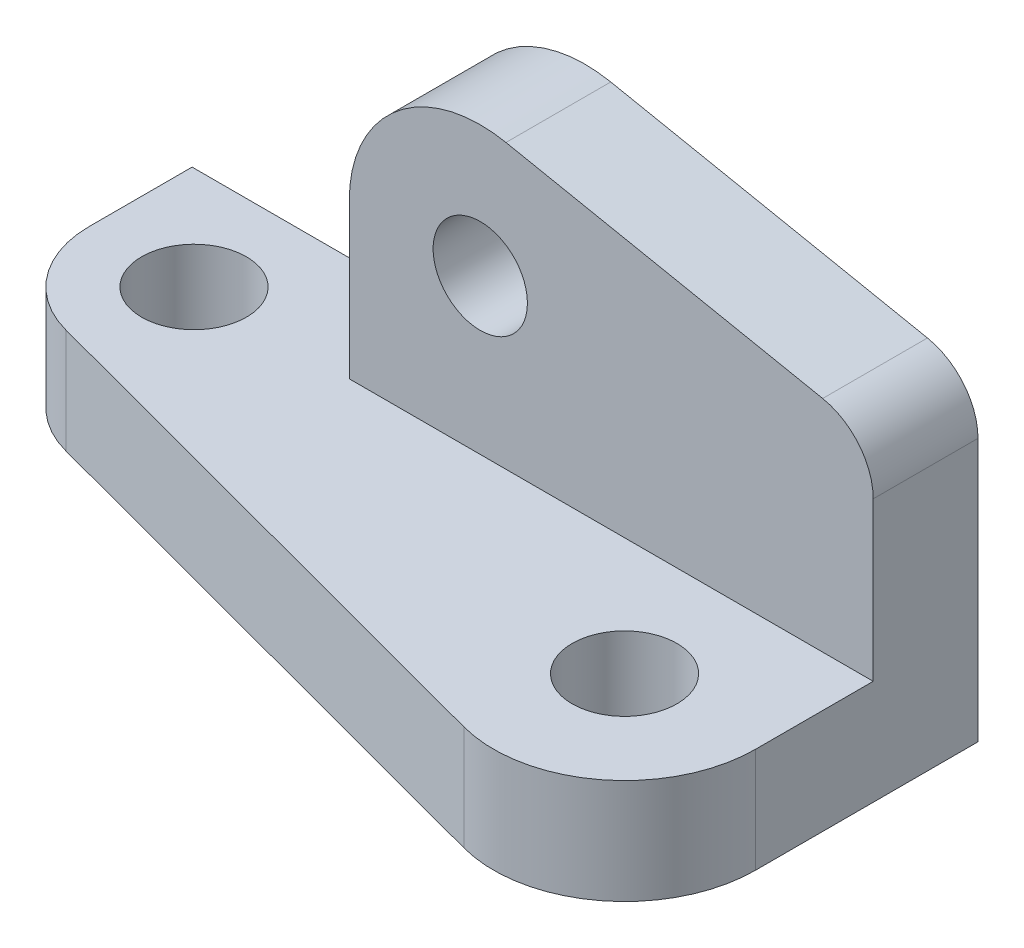
from build123d import *

# Parameters (mm, degrees)
BOSS_EXTRUDE1_DEPTH        = 20
BOSS_EXTRUDE2_DEPTH        = 20
FILLET1_R                  = 20
FILLET2_R                  = 25
FILLET3_R                  = 12
F_18_0_18_DIAMETER_HOLE1_D = 18
F_20_0_20_DIAMETER_HOLE1_D = 20


with BuildPart() as part:
    # Sketch1 → Boss-Extrude1 (new body)
    with BuildSketch(Plane(origin=(0, 0, 0), x_dir=(1, 0, 0), z_dir=(0, 1, 0))):
        Polygon((0, 0), (150, 0), (150, -75), (0, -35), align=None)
    extrude(amount=BOSS_EXTRUDE1_DEPTH)

    # Sketch2 → Boss-Extrude2 (add)
    with BuildSketch(Plane(origin=(0, 0, 0), x_dir=(-1, 0, 0), z_dir=(0, 0, -1))):
        Polygon((-150, 0), (-150, 60), (-50, 80), (-50, 0), align=None)
    extrude(amount=-BOSS_EXTRUDE2_DEPTH)

    # Fillet1
    fillet1_edges = [part.edges().sort_by_distance(p)[0] for p in [
        (0, 10, 35),
    ]]
    fillet(fillet1_edges, radius=FILLET1_R)

    # Fillet2
    fillet2_edges = [part.edges().sort_by_distance(p)[0] for p in [
        (50, 80, 10),
        (150, 10, 75),
    ]]
    fillet(fillet2_edges, radius=FILLET2_R)

    # Fillet3
    fillet3_edges = [part.edges().sort_by_distance(p)[0] for p in [
        (150, 60, 10),
    ]]
    fillet(fillet3_edges, radius=FILLET3_R)

    # Ø18.0 (18) Diameter Hole1 (through all)
    with Locations(Plane.XY.offset(20)):
        with Locations((75, 49.504902432)):
            Hole(F_18_0_18_DIAMETER_HOLE1_D / 2)

    # Ø20.0 (20) Diameter Hole1 (through all)
    with Locations(Plane(origin=(0, 20, 0), x_dir=(1, 0, 0), z_dir=(0, 1, 0))):
        with Locations((20, -19.634433738), (125, -42.45970884)):
            Hole(F_20_0_20_DIAMETER_HOLE1_D / 2)


solid = part.part
